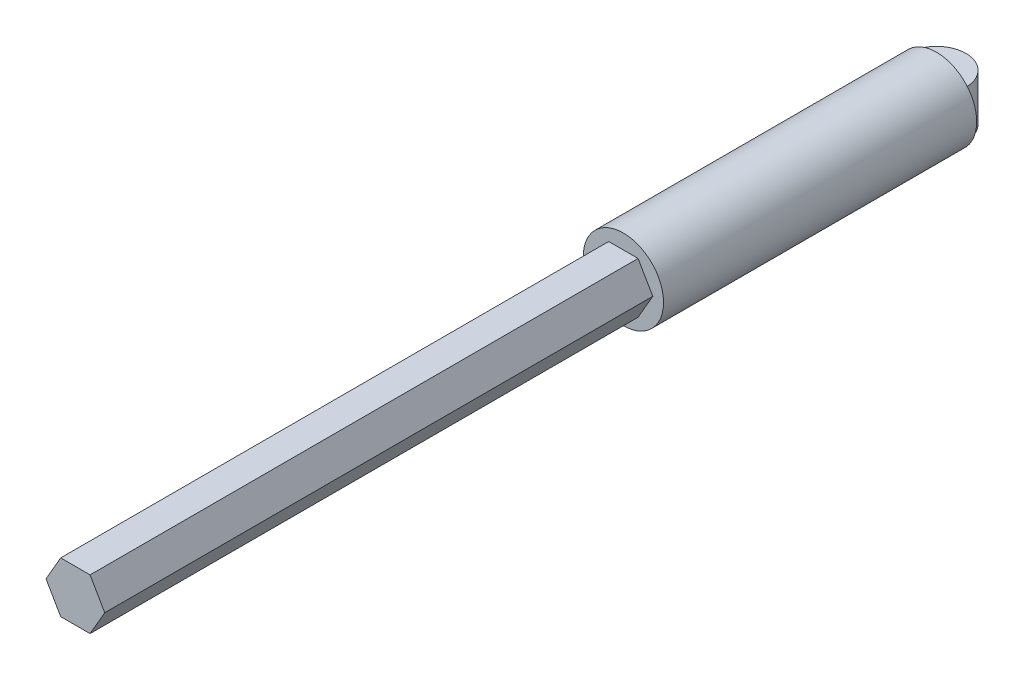
from build123d import *

# Parameters (mm, degrees)
SKETCH1_R                = 1.025
BOSS_EXTRUDE1_DEPTH      = 5
BOSS_EXTRUDE5_DEPTH      = 0.25
BOSS_EXTRUDE5_DEPTH_BACK = 0.2
BOSS_EXTRUDE6_DEPTH      = 0.375
BOSS_EXTRUDE7_START      = 0.375
BOSS_EXTRUDE7_DEPTH      = 0.375
BOSS_EXTRUDE9_DEPTH      = 14
SKETCH7_R                = 1.025
BOSS_EXTRUDE10_DEPTH     = 3
BOSS_EXTRUDE11_DEPTH     = 3


with BuildPart() as part:
    # Sketch1 → Boss-Extrude1 (new body)
    with BuildSketch(Plane.XY):
        Circle(SKETCH1_R)
    extrude(amount=BOSS_EXTRUDE1_DEPTH)

    # Sketch3 → Boss-Extrude5 (add, two sides: drawn at the far end of the back side and taken through both)
    with BuildSketch(Plane(origin=(0, 0, 0), x_dir=(1, 0, 0), z_dir=(0, 1, 0)).offset(-BOSS_EXTRUDE5_DEPTH_BACK)):
        with BuildLine():
            Line((-0.75, 0), (0.75, 0))
            ThreePointArc((0.75, 0), (0, 0.75), (-0.75, 0))
        make_face()
    extrude(amount=BOSS_EXTRUDE5_DEPTH + BOSS_EXTRUDE5_DEPTH_BACK)

    # Sketch5 → Boss-Extrude6 (add)
    with BuildSketch(Plane(origin=(0, 0.25, 0), x_dir=(1, 0, 0), z_dir=(0, 1, 0))):
        with BuildLine():
            Line((-0.75, 0), (0.75, 0))
            ThreePointArc((0.75, 0), (0, 0.75), (-0.75, 0))
        make_face()
    extrude(amount=BOSS_EXTRUDE6_DEPTH)

    # Sketch6 → Boss-Extrude7 (add)
    with BuildSketch(Plane.XZ.offset(0.2).offset(BOSS_EXTRUDE7_START)):
        with BuildLine():
            Line((0.75, 0), (-0.75, 0))
            ThreePointArc((-0.75, 0), (0, -0.75), (0.75, 0))
        make_face()
    extrude(amount=-BOSS_EXTRUDE7_DEPTH)

    # Sketch2 → Boss-Extrude9 (add)
    with BuildSketch(Plane.XY.offset(5)):
        Polygon((0.75055535, 0), (0.375277675, 0.65), (-0.375277675, 0.65), (-0.75055535, 0), (-0.375277675, -0.65), (0.375277675, -0.65), align=None)
    extrude(amount=BOSS_EXTRUDE9_DEPTH)

    # Sketch7 → Boss-Extrude10 (add)
    with BuildSketch(Plane.XY.offset(5)):
        Circle(SKETCH7_R)
    extrude(amount=BOSS_EXTRUDE10_DEPTH)

    # Sketch8 → Boss-Extrude11 (add)
    with BuildSketch(Plane.XY.offset(19)):
        Polygon((0.75055535, 0), (0.375277675, 0.65), (-0.375277675, 0.65), (-0.75055535, 0), (-0.375277675, -0.65), (0.375277675, -0.65), align=None)
    extrude(amount=BOSS_EXTRUDE11_DEPTH)


solid = part.part
